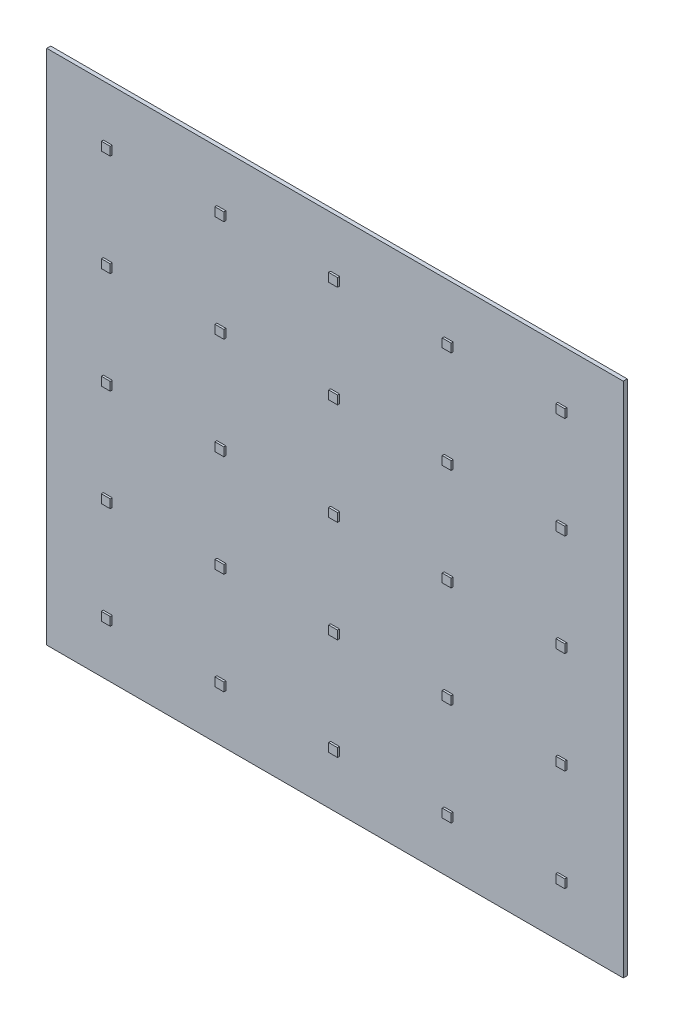
from build123d import *

# Parameters (mm, degrees)
SKETCH_1_W      = 145
SKETCH_1_H      = 130
EXTRUDE_1_DEPTH = 1
SKETCH_2_W      = 2.25
SKETCH_2_H      = 2.15
EXTRUDE_2_DEPTH = 0.5


with BuildPart() as part:
    # 草图1 → 凸台-拉伸1 (new body)
    with BuildSketch(Plane.XY):
        Rectangle(SKETCH_1_W, SKETCH_1_H)
    extrude(amount=EXTRUDE_1_DEPTH)

    # 草图2 → 凸台-拉伸2 (add)
    with BuildSketch(Plane.XY.offset(1)):
        with Locations((-28.58, 51.063510548)):
            Rectangle(SKETCH_2_W, SKETCH_2_H)
        with Locations((-57.16, 51.063510548)):
            Rectangle(SKETCH_2_W, SKETCH_2_H)
        with Locations((0, 51.063510548)):
            Rectangle(SKETCH_2_W, SKETCH_2_H)
        with Locations((28.58, 51.063510548)):
            Rectangle(SKETCH_2_W, SKETCH_2_H)
        with Locations((57.16, 51.063510548)):
            Rectangle(SKETCH_2_W, SKETCH_2_H)
        with Locations((-28.58, 25.463510548)):
            Rectangle(SKETCH_2_W, SKETCH_2_H)
        with Locations((0, 25.463510548)):
            Rectangle(SKETCH_2_W, SKETCH_2_H)
        with Locations((28.58, 25.463510548)):
            Rectangle(SKETCH_2_W, SKETCH_2_H)
        with Locations((57.16, 25.463510548)):
            Rectangle(SKETCH_2_W, SKETCH_2_H)
        with Locations((-28.58, -0.136489452)):
            Rectangle(SKETCH_2_W, SKETCH_2_H)
        with Locations((0, -0.136489452)):
            Rectangle(SKETCH_2_W, SKETCH_2_H)
        with Locations((28.58, -0.136489452)):
            Rectangle(SKETCH_2_W, SKETCH_2_H)
        with Locations((57.16, -0.136489452)):
            Rectangle(SKETCH_2_W, SKETCH_2_H)
        with Locations((-28.58, -25.736489452)):
            Rectangle(SKETCH_2_W, SKETCH_2_H)
        with Locations((0, -25.736489452)):
            Rectangle(SKETCH_2_W, SKETCH_2_H)
        with Locations((28.58, -25.736489452)):
            Rectangle(SKETCH_2_W, SKETCH_2_H)
        with Locations((57.16, -25.736489452)):
            Rectangle(SKETCH_2_W, SKETCH_2_H)
        with Locations((-28.58, -51.336489452)):
            Rectangle(SKETCH_2_W, SKETCH_2_H)
        with Locations((0, -51.336489452)):
            Rectangle(SKETCH_2_W, SKETCH_2_H)
        with Locations((28.58, -51.336489452)):
            Rectangle(SKETCH_2_W, SKETCH_2_H)
        with Locations((57.16, -51.336489452)):
            Rectangle(SKETCH_2_W, SKETCH_2_H)
        with Locations((-57.16, 25.463510548)):
            Rectangle(SKETCH_2_W, SKETCH_2_H)
        with Locations((-57.16, -0.136489452)):
            Rectangle(SKETCH_2_W, SKETCH_2_H)
        with Locations((-57.16, -25.736489452)):
            Rectangle(SKETCH_2_W, SKETCH_2_H)
        with Locations((-57.16, -51.336489452)):
            Rectangle(SKETCH_2_W, SKETCH_2_H)
    extrude(amount=EXTRUDE_2_DEPTH)


solid = part.part
